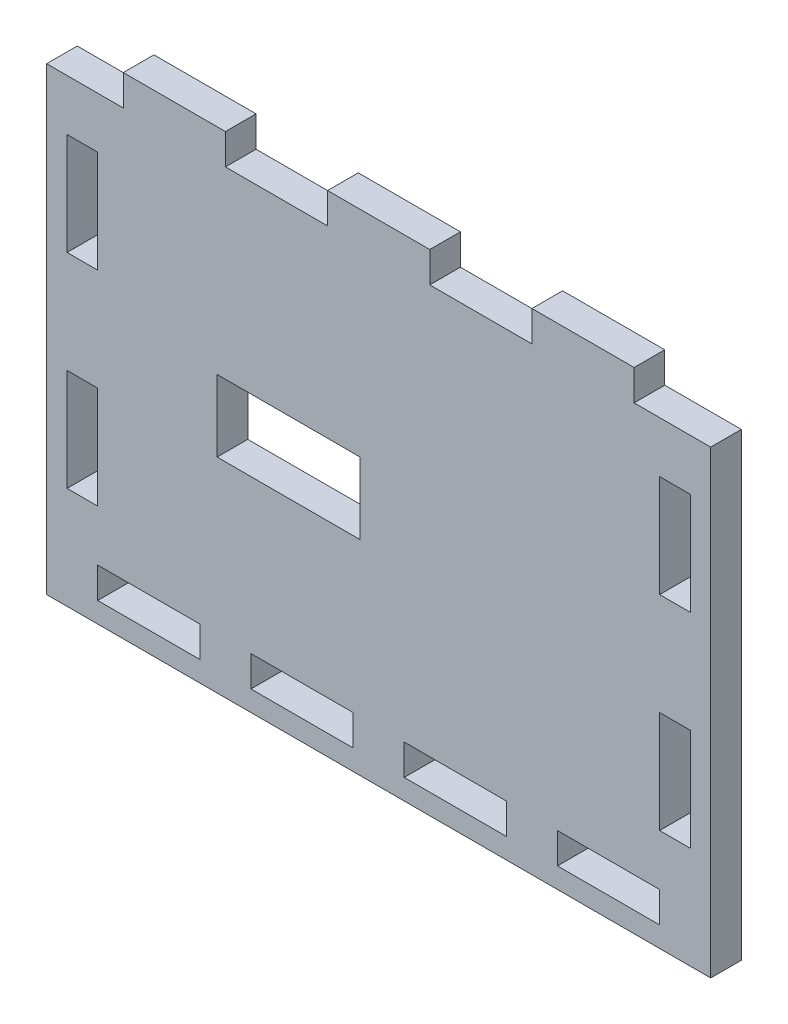
from build123d import *

# Parameters (mm, degrees)
SKETCH_1_W          = 10
SKETCH_1_H          = 3
SKETCH_1_W_2        = 3
SKETCH_1_H_2        = 10
EXTRUDE_1_DEPTH     = 3
SKETCH_2_W          = 14
SKETCH_2_H          = 7
CUT_EXTRUDE_1_DEPTH = 10


with BuildPart() as part:
    # 草图1 → 凸台-拉伸1 (new body)
    with BuildSketch(Plane.XY):
        Polygon((-5, 22.5), (-5, 25.5), (5, 25.5), (5, 22.5), (15, 22.5), (15, 25.5), (25, 25.5), (25, 22.5), (32.5, 22.5), (32.5, -22.5), (-32.5, -22.5), (-32.5, 22.5), (-25, 22.5), (-25, 25.5), (-15, 25.5), (-15, 22.5), align=None)
        with Locations((-7.5, -19)):
            Rectangle(SKETCH_1_W, SKETCH_1_H, mode=Mode.SUBTRACT)
        with Locations((-22.5, -19)):
            Rectangle(SKETCH_1_W, SKETCH_1_H, mode=Mode.SUBTRACT)
        with Locations((7.5, -19)):
            Rectangle(SKETCH_1_W, SKETCH_1_H, mode=Mode.SUBTRACT)
        with Locations((22.5, -19)):
            Rectangle(SKETCH_1_W, SKETCH_1_H, mode=Mode.SUBTRACT)
        with Locations((-29, -7.5)):
            Rectangle(SKETCH_1_W_2, SKETCH_1_H_2, mode=Mode.SUBTRACT)
        with Locations((-29, 12.5)):
            Rectangle(SKETCH_1_W_2, SKETCH_1_H_2, mode=Mode.SUBTRACT)
        with Locations((29, -7.5)):
            Rectangle(SKETCH_1_W_2, SKETCH_1_H_2, mode=Mode.SUBTRACT)
        with Locations((29, 12.5)):
            Rectangle(SKETCH_1_W_2, SKETCH_1_H_2, mode=Mode.SUBTRACT)
    extrude(amount=EXTRUDE_1_DEPTH)

    # 草图2 → 切除-拉伸1 (cut)
    with BuildSketch(Plane.XY.offset(3)):
        with Locations((-8.812746432, 1)):
            Rectangle(SKETCH_2_W, SKETCH_2_H)
    extrude(amount=-CUT_EXTRUDE_1_DEPTH, mode=Mode.SUBTRACT)


solid = part.part
